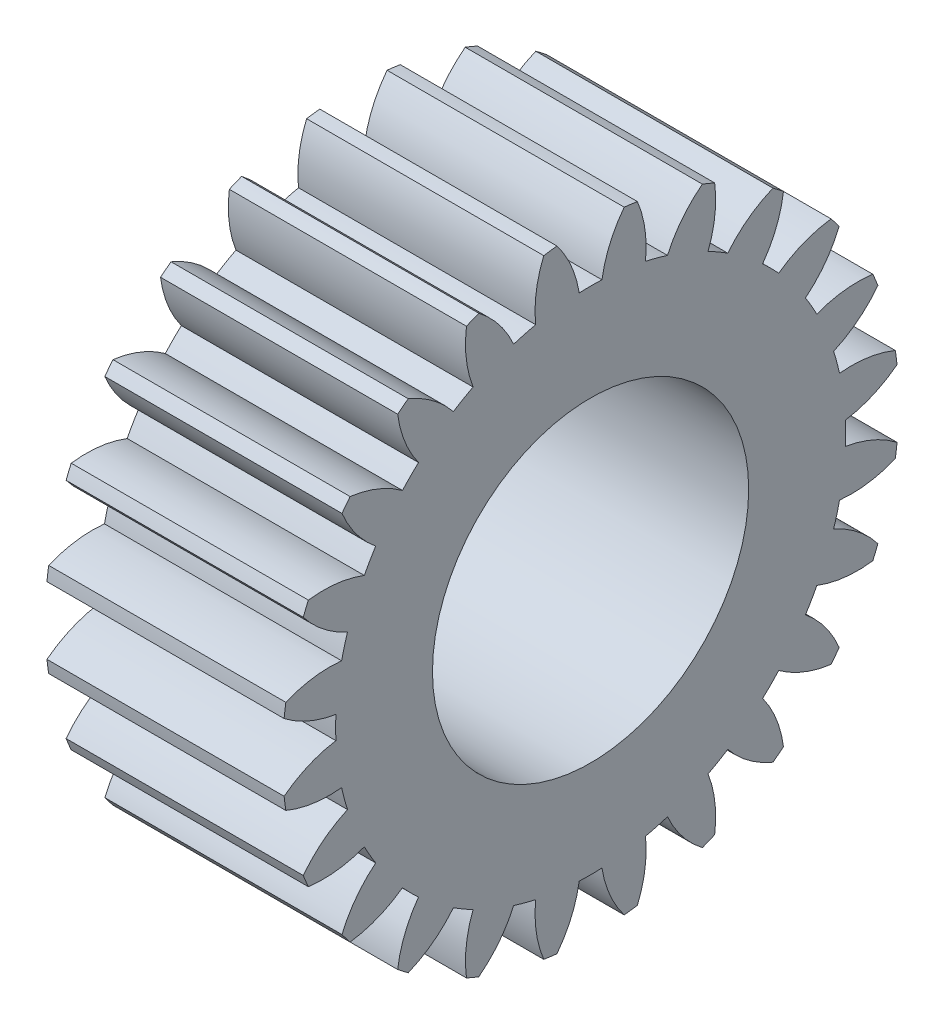
from build123d import *

# Parameters (mm, degrees)
BASPROSKE_W     = 30
BASPROSKE_H     = 39
TOOTHCUT_DEPTH  = 63.785348609
TEETHCUTS_COUNT = 24
TEETHCUTS_ANGLE = 345
BORSKE_R        = 20
BORE_DEPTH      = 50.0000508


with BuildPart() as part:
    # BasProSke → Base-Revolve (revolve)
    with BuildSketch(Plane(origin=(0, 0, 0), x_dir=(1, 0, 0), z_dir=(0, 1, 0)), mode=Mode.PRIVATE) as base_revolve_sk:
        with Locations((15, 19.5)):
            Rectangle(BASPROSKE_W, BASPROSKE_H)
    revolve(base_revolve_sk.sketch.rotate(Axis((-10, 0, 0), (1, 0, 0)), 180), axis=Axis((-10, 0, 0), (1, 0, 0)))

    # TooCutSke → ToothCut (cut, through all)
    with BuildSketch(Plane(origin=(0, 0, 0), x_dir=(0, 0, -1), z_dir=(1, 0, 0))):
        with BuildLine():
            ThreePointArc((1.439675441, 32.21684863), (0, 32.249), (-1.439675441, 32.21684863))
            ThreePointArc((-1.439675441, 32.21684863), (-2.441315456, 35.682674447), (-4.272982149, 38.79076525))
            ThreePointArc((-4.272982149, 38.79076525), (0, 39.0254), (4.272982149, 38.79076525))
            ThreePointArc((4.272982149, 38.79076525), (2.441315456, 35.682674447), (1.439675441, 32.21684863))
        make_face()
    toothcut = extrude(amount=TOOTHCUT_DEPTH, mode=Mode.SUBTRACT)

    # TeethCuts: ToothCut ×24 about axis
    teethcuts_axis = Axis((-10, 0, 0), (1, 0, 0))
    for i in range(1, TEETHCUTS_COUNT):
        add(toothcut.rotate(teethcuts_axis, i * TEETHCUTS_ANGLE / (TEETHCUTS_COUNT - 1)), mode=Mode.SUBTRACT)

    # BorSke → Bore (cut, symmetric)
    with BuildSketch(Plane(origin=(0, 0, 0), x_dir=(0, 0, -1), z_dir=(1, 0, 0))):
        with Locations(Location((0, 0, 0), (0, 0, 180))):
            Circle(BORSKE_R)
    extrude(amount=BORE_DEPTH, both=True, mode=Mode.SUBTRACT)


solid = part.part
